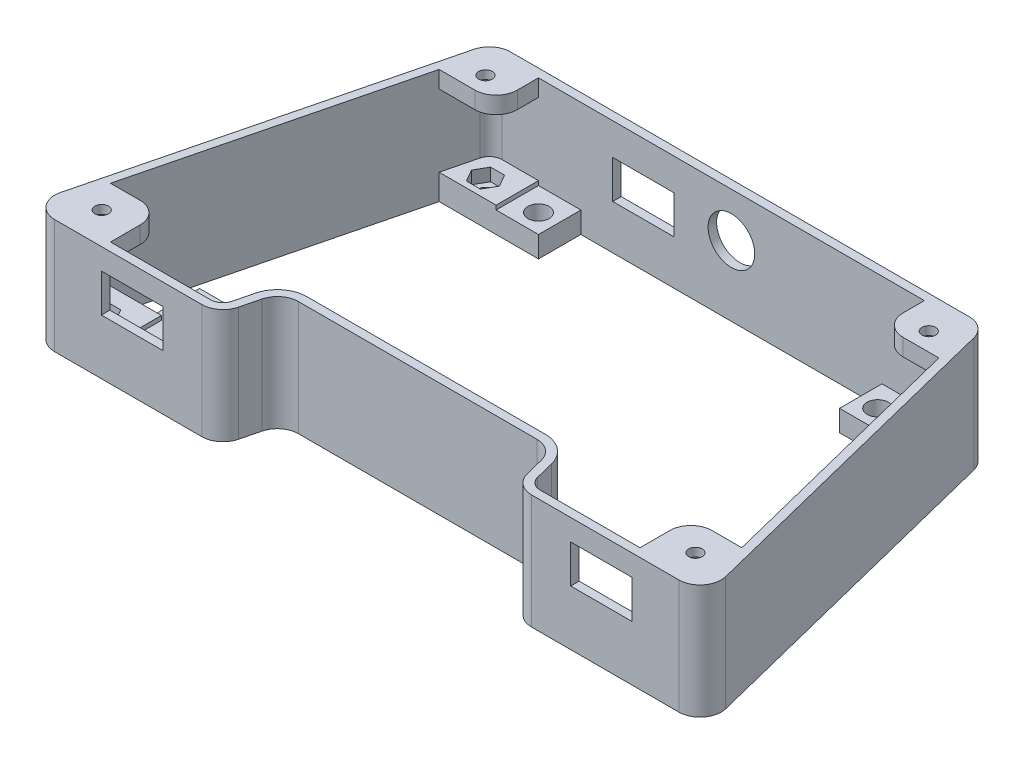
from build123d import *

# Parameters (mm, degrees)
Y_KSEKLIK_EKSTR_ZYON1_DEPTH      = 3
Y_KSEKLIK_EKSTR_ZYON2_DEPTH      = 24
KES_EKSTR_ZYON1_START            = -27
KES_EKSTR_ZYON1_DEPTH            = 27
IZIM4_R                          = 5.5
KES_EKSTR_ZYON2_DEPTH            = 10
IZIM5_W                          = 14.5
IZIM5_H                          = 9
KES_EKSTR_ZYON3_DEPTH            = 10
IZIM7_R                          = 1.65
Y_KSEKLIK_EKSTR_ZYON3_DEPTH      = 2
IZIM8_R                          = 1.65
Y_KSEKLIK_EKSTR_ZYON4_DEPTH      = 2
KES_EKSTR_ZYON5_DEPTH            = 10
IZIM13_W                         = 14.5
IZIM13_H                         = 9
KES_EKSTR_ZYON6_DEPTH            = 10
Y_KSEKLIK_EKSTR_ZYON5_START      = -2
Y_KSEKLIK_EKSTR_ZYON5_DEPTH      = 2
Y_KSEKLIK_EKSTR_ZYON6_DEPTH      = 3
Y_KSEKLIK_EKSTR_ZYON6_DEPTH_BACK = 2
IZIM15_W                         = 10
IZIM15_H                         = 12
IZIM15_R                         = 1.6
Y_KSEKLIK_EKSTR_ZYON7_DEPTH      = 4
IZIM17_R                         = 1.6
Y_KSEKLIK_EKSTR_ZYON8_DEPTH      = 3
IZIM18_R                         = 1.6
KES_EKSTR_ZYON7_DEPTH            = 3
KES_EKSTR_ZYON8_DEPTH            = 3
KES_EKSTR_ZYON9_DEPTH            = 10
IZIM21_R                         = 2.5
KES_EKSTR_ZYON10_DEPTH           = 10
Y_KSEKLIK_EKSTR_ZYON9_START      = -2
Y_KSEKLIK_EKSTR_ZYON9_DEPTH      = 2
Y_KSEKLIK_EKSTR_ZYON10_DEPTH     = 4
IZIM24_R                         = 1.6
Y_KSEKLIK_EKSTR_ZYON11_DEPTH     = 2
KES_EKSTR_ZYON12_START           = -10
IZIM25_R                         = 1.6
KES_EKSTR_ZYON12_DEPTH           = 10
KES_EKSTR_ZYON13_DEPTH           = 3
Y_KSEKLIK_EKSTR_ZYON12_DEPTH     = 3
IZIM28_W                         = 2
IZIM28_H                         = 8
Y_KSEKLIK_EKSTR_ZYON13_DEPTH     = 5
IZIM29_R                         = 2.5
KES_EKSTR_ZYON14_DEPTH           = 10
Y_KSEKLIK_EKSTR_ZYON14_DEPTH     = 5
Y_KSEKLIK_EKSTR_ZYON15_START     = -4
IZIM31_R                         = 1.6
Y_KSEKLIK_EKSTR_ZYON15_DEPTH     = 4
KES_EKSTR_ZYON15_DEPTH           = 2
RADYUS1_R                        = 5


with BuildPart() as part:
    # Çizim1 → Yükseklik-Ekstrüzyon1 (new body)
    with BuildSketch(Plane(origin=(0, 0, 0), x_dir=(1, 0, 0), z_dir=(0, 1, 0))):
        with BuildLine():
            Line((3.903882032, 0), (112.096117968, 0))
            ThreePointArc((112.096117968, 0), (115.173179015, -1.05897281), (116.946830469, -3.787321875))
            Line((116.946830469, -3.787321875), (136.446830469, -81.787321875))
            ThreePointArc((136.446830469, -81.787321875), (135.537145158, -86.077061047), (131.596117968, -88))
            Line((131.596117968, -88), (96.903882032, -88))
            ThreePointArc((96.903882032, -88), (93.826820985, -86.94102719), (92.053169531, -84.212678125))
            Line((92.053169531, -84.212678125), (90.946830469, -79.787321875))
            ThreePointArc((90.946830469, -79.787321875), (89.173179015, -77.05897281), (86.096117968, -76))
            Line((86.096117968, -76), (29.903882032, -76))
            ThreePointArc((29.903882032, -76), (26.826820985, -77.05897281), (25.053169531, -79.787321875))
            Line((25.053169531, -79.787321875), (23.946830469, -84.212678125))
            ThreePointArc((23.946830469, -84.212678125), (22.173179015, -86.94102719), (19.096117968, -88))
            Line((19.096117968, -88), (-15.596117968, -88))
            ThreePointArc((-15.596117968, -88), (-19.537145158, -86.077061047), (-20.446830469, -81.787321875))
            Line((-20.446830469, -81.787321875), (-0.946830469, -3.787321875))
            ThreePointArc((-0.946830469, -3.787321875), (0.826820985, -1.05897281), (3.903882032, 0))
        make_face()
    extrude(amount=Y_KSEKLIK_EKSTR_ZYON1_DEPTH)

    # Çizim2 → Yükseklik-Ekstrüzyon2 (add)
    with BuildSketch(Plane(origin=(0, 3, 0), x_dir=(1, 0, 0), z_dir=(0, 1, 0))):
        with BuildLine():
            Line((23.946830469, -84.212678125), (25.053169531, -79.787321875))
            ThreePointArc((25.053169531, -79.787321875), (26.826820985, -77.05897281), (29.903882032, -76))
            Line((29.903882032, -76), (86.096117968, -76))
            ThreePointArc((86.096117968, -76), (89.173179015, -77.05897281), (90.946830469, -79.787321875))
            Line((90.946830469, -79.787321875), (92.053169531, -84.212678125))
            ThreePointArc((92.053169531, -84.212678125), (93.826820985, -86.94102719), (96.903882032, -88))
            Line((96.903882032, -88), (131.596117968, -88))
            ThreePointArc((131.596117968, -88), (135.537145158, -86.077061047), (136.446830469, -81.787321875))
            Line((136.446830469, -81.787321875), (116.946830469, -3.787321875))
            ThreePointArc((116.946830469, -3.787321875), (115.173179015, -1.05897281), (112.096117968, 0))
            Line((112.096117968, 0), (3.903882032, 0))
            ThreePointArc((3.903882032, 0), (0.826820985, -1.05897281), (-0.946830469, -3.787321875))
            Line((-0.946830469, -3.787321875), (-20.446830469, -81.787321875))
            ThreePointArc((-20.446830469, -81.787321875), (-19.537145158, -86.077061047), (-15.596117968, -88))
            Line((-15.596117968, -88), (19.096117968, -88))
            ThreePointArc((19.096117968, -88), (22.173179015, -86.94102719), (23.946830469, -84.212678125))
        make_face()
        with BuildLine():
            Line((22.006545468, -83.727606875), (23.112884531, -79.302250625))
            ThreePointArc((23.112884531, -79.302250625), (25.595996566, -75.482561934), (29.903882032, -74))
            Line((29.903882032, -74), (86.096117968, -74))
            ThreePointArc((86.096117968, -74), (90.404003434, -75.482561934), (92.887115469, -79.302250625))
            Line((92.887115469, -79.302250625), (93.993454532, -83.727606875))
            ThreePointArc((93.993454532, -83.727606875), (95.057645404, -85.364616314), (96.903882032, -86))
            Line((96.903882032, -86), (131.596117968, -86))
            ThreePointArc((131.596117968, -86), (133.960734282, -84.846236628), (134.506545468, -82.272393125))
            Line((134.506545468, -82.272393125), (115.006545468, -4.272393125))
            ThreePointArc((115.006545468, -4.272393125), (113.942354596, -2.635383686), (112.096117968, -2))
            Line((112.096117968, -2), (3.903882032, -2))
            ThreePointArc((3.903882032, -2), (2.057645404, -2.635383686), (0.993454532, -4.272393125))
            Line((0.993454532, -4.272393125), (-18.506545468, -82.272393125))
            ThreePointArc((-18.506545468, -82.272393125), (-17.960734282, -84.846236628), (-15.596117968, -86))
            Line((-15.596117968, -86), (19.096117968, -86))
            ThreePointArc((19.096117968, -86), (20.942354596, -85.364616314), (22.006545468, -83.727606875))
        make_face(mode=Mode.SUBTRACT)
    extrude(amount=Y_KSEKLIK_EKSTR_ZYON2_DEPTH)

    # Çizim3 → Kes-Ekstrüzyon1 (cut)
    with BuildSketch(Plane(origin=(0, 3, 0), x_dir=(1, 0, 0), z_dir=(0, 1, 0)).offset(KES_EKSTR_ZYON1_START)):
        with BuildLine():
            Line((-15.596117968, -86), (19.096117968, -86))
            ThreePointArc((19.096117968, -86), (20.942354596, -85.364616314), (22.006545468, -83.727606875))
            Line((22.006545468, -83.727606875), (23.112884531, -79.302250625))
            ThreePointArc((23.112884531, -79.302250625), (25.595996566, -75.482561934), (29.903882032, -74))
            Line((29.903882032, -74), (86.096117968, -74))
            ThreePointArc((86.096117968, -74), (90.404003434, -75.482561934), (92.887115469, -79.302250625))
            Line((92.887115469, -79.302250625), (93.993454532, -83.727606875))
            ThreePointArc((93.993454532, -83.727606875), (95.057645404, -85.364616314), (96.903882032, -86))
            Line((96.903882032, -86), (131.596117968, -86))
            ThreePointArc((131.596117968, -86), (133.960734282, -84.846236628), (134.506545468, -82.272393125))
            Line((134.506545468, -82.272393125), (115.006545468, -4.272393125))
            ThreePointArc((115.006545468, -4.272393125), (113.942354596, -2.635383686), (112.096117968, -2))
            Line((112.096117968, -2), (3.903882032, -2))
            ThreePointArc((3.903882032, -2), (2.057645404, -2.635383686), (0.993454532, -4.272393125))
            Line((0.993454532, -4.272393125), (-18.506545468, -82.272393125))
            ThreePointArc((-18.506545468, -82.272393125), (-17.960734282, -84.846236628), (-15.596117968, -86))
        make_face()
    extrude(amount=KES_EKSTR_ZYON1_DEPTH, mode=Mode.SUBTRACT)

    # Çizim4 → Kes-Ekstrüzyon2 (cut)
    with BuildSketch(Plane(origin=(0, 0, 0), x_dir=(-1, 0, 0), z_dir=(0, 0, -1))):
        with Locations((-58, 16.5)):
            Circle(IZIM4_R)
    extrude(amount=-KES_EKSTR_ZYON2_DEPTH, mode=Mode.SUBTRACT)

    # Çizim5 → Kes-Ekstrüzyon3 (cut)
    with BuildSketch(Plane(origin=(0, 0, 0), x_dir=(-1, 0, 0), z_dir=(0, 0, -1))):
        with Locations((-37.25, 15)):
            Rectangle(IZIM5_W, IZIM5_H)
    extrude(amount=-KES_EKSTR_ZYON3_DEPTH, mode=Mode.SUBTRACT)

    # Çizim7 → Yükseklik-Ekstrüzyon3 (add)
    # profile 1 of 2: a face of its own
    with BuildSketch(Plane.XZ):
        with BuildLine():
            Line((10.561552813, 2), (10.561552813, 10))
            ThreePointArc((10.561552813, 10), (9.389979938, 12.828427125), (6.561552813, 14))
            Line((6.561552813, 14), (-1.438447187, 14))
            Line((-1.438447187, 14), (0.993454532, 4.272393125))
            ThreePointArc((0.993454532, 4.272393125), (2.057645404, 2.635383686), (3.903882032, 2))
            Line((3.903882032, 2), (10.561552813, 2))
        make_face()
        with Locations(Location((5.723812671, 7.731905405, 0), (0, 0, 270))):
            Circle(IZIM7_R, mode=Mode.SUBTRACT)
    # profile 2 of 2: a face of its own
    with BuildSketch(Plane.XZ):
        with BuildLine():
            Line((112.096117968, 2), (105.438447187, 2))
            Line((105.438447187, 2), (105.438447187, 10))
            ThreePointArc((105.438447187, 10), (106.610020062, 12.828427125), (109.438447187, 14))
            Line((109.438447187, 14), (117.438447187, 14))
            Line((117.438447187, 14), (115.006545468, 4.272393125))
            ThreePointArc((115.006545468, 4.272393125), (113.942354596, 2.635383686), (112.096117968, 2))
        make_face()
        with Locations(Location((110.276187329, 7.731905405, 0), (0, 0, 270))):
            Circle(IZIM7_R, mode=Mode.SUBTRACT)
    extrude(amount=-Y_KSEKLIK_EKSTR_ZYON3_DEPTH)

    # Çizim8 → Yükseklik-Ekstrüzyon4 (add)
    # profile 1 of 2: a face of its own
    with BuildSketch(Plane.XZ):
        with BuildLine():
            Line((132.438447187, 74), (124.438447187, 74))
            ThreePointArc((124.438447187, 74), (121.610020062, 75.171572875), (120.438447187, 78))
            Line((120.438447187, 78), (120.438447187, 86))
            Line((120.438447187, 86), (131.596117968, 86))
            ThreePointArc((131.596117968, 86), (133.960734282, 84.846236628), (134.506545468, 82.272393125))
            Line((134.506545468, 82.272393125), (132.438447187, 74))
        make_face()
        with Locations(Location((128.017282578, 80.5, 0), (0, 0, 270))):
            Circle(IZIM8_R, mode=Mode.SUBTRACT)
    # profile 2 of 2: a face of its own
    with BuildSketch(Plane.XZ):
        with BuildLine():
            Line((-16.438447187, 74), (-18.506545468, 82.272393125))
            ThreePointArc((-18.506545468, 82.272393125), (-17.960734282, 84.846236628), (-15.596117968, 86))
            Line((-15.596117968, 86), (-4.438447187, 86))
            Line((-4.438447187, 86), (-4.438447187, 78))
            ThreePointArc((-4.438447187, 78), (-5.610020062, 75.171572875), (-8.438447187, 74))
            Line((-8.438447187, 74), (-16.438447187, 74))
        make_face()
        with Locations(Location((-12.017282578, 80.5, 0), (0, 0, 90))):
            Circle(IZIM8_R, mode=Mode.SUBTRACT)
    extrude(amount=-Y_KSEKLIK_EKSTR_ZYON4_DEPTH)

    # Çizim12 → Kes-Ekstrüzyon5 (cut)
    with BuildSketch(Plane(origin=(0, 2, 0), x_dir=(1, 0, 0), z_dir=(0, 1, 0))):
        Polygon((7.455863478, -4.731905405), (3.991761863, -4.731905405), (2.259711056, -7.731905405), (3.991761863, -10.731905405), (7.455863478, -10.731905405), (9.187914286, -7.731905405), align=None)
        Polygon((-8.553180962, -80.5), (-10.28523177, -77.5), (-13.749333385, -77.5), (-15.481384193, -80.5), (-13.749333385, -83.5), (-10.28523177, -83.5), align=None)
        Polygon((126.28523177, -83.5), (124.553180962, -80.5), (126.28523177, -77.5), (129.749333385, -77.5), (131.481384193, -80.5), (129.749333385, -83.5), align=None)
        Polygon((106.812085714, -7.731905405), (108.544136522, -4.731905405), (112.008238137, -4.731905405), (113.740288944, -7.731905405), (112.008238137, -10.731905405), (108.544136522, -10.731905405), align=None)
    extrude(amount=-KES_EKSTR_ZYON5_DEPTH, mode=Mode.SUBTRACT)

    # Çizim13 → Kes-Ekstrüzyon6 (cut)
    with BuildSketch(Plane.XY.offset(88)):
        with Locations((2.653882032, 17.5)):
            Rectangle(IZIM13_W, IZIM13_H)
        with Locations((113.343882032, 17.5)):
            Rectangle(IZIM13_W, IZIM13_H)
    extrude(amount=-KES_EKSTR_ZYON6_DEPTH, mode=Mode.SUBTRACT)

    # Çizim14 → Yükseklik-Ekstrüzyon5 (add)
    with BuildSketch(Plane(origin=(0, 2, 0), x_dir=(1, 0, 0), z_dir=(0, 1, 0)).offset(Y_KSEKLIK_EKSTR_ZYON5_START)):
        with BuildLine():
            Line((6.561552813, -14), (12.5, -14))
            Line((12.5, -14), (12.5, -2))
            Line((12.5, -2), (10.561552813, -2))
            Line((10.561552813, -2), (10.561552813, -10))
            ThreePointArc((10.561552813, -10), (9.389979938, -12.828427125), (6.561552813, -14))
        make_face()
        with BuildLine():
            Line((109.438447187, -14), (103.5, -14))
            Line((103.5, -14), (103.5, -2))
            Line((103.5, -2), (105.438447187, -2))
            Line((105.438447187, -2), (105.438447187, -10))
            ThreePointArc((105.438447187, -10), (106.610020062, -12.828427125), (109.438447187, -14))
        make_face()
    extrude(amount=Y_KSEKLIK_EKSTR_ZYON5_DEPTH)

    # Çizim15 → Yükseklik-Ekstrüzyon6 (add, two sides: drawn at the far end of the back side and taken through both)
    # profile 1 of 2: a face of its own
    with BuildSketch(Plane(origin=(0, 2, 0), x_dir=(1, 0, 0), z_dir=(0, 1, 0)).offset(-Y_KSEKLIK_EKSTR_ZYON6_DEPTH_BACK)):
        with Locations((17.5, -8)):
            Rectangle(IZIM15_W, IZIM15_H)
        with Locations(Location((18, -7.5, 0), (0, 0, 270))):
            Circle(IZIM15_R, mode=Mode.SUBTRACT)
    # profile 2 of 2: a face of its own
    with BuildSketch(Plane(origin=(0, 2, 0), x_dir=(1, 0, 0), z_dir=(0, 1, 0)).offset(-Y_KSEKLIK_EKSTR_ZYON6_DEPTH_BACK)):
        with Locations((98.5, -8)):
            Rectangle(IZIM15_W, IZIM15_H)
        with Locations(Location((98, -7.5, 0), (0, 0, 270))):
            Circle(IZIM15_R, mode=Mode.SUBTRACT)
    extrude(amount=Y_KSEKLIK_EKSTR_ZYON6_DEPTH + Y_KSEKLIK_EKSTR_ZYON6_DEPTH_BACK)

    # Çizim16 → Yükseklik-Ekstrüzyon7 (add)
    with BuildSketch(Plane(origin=(0, 2, 0), x_dir=(1, 0, 0), z_dir=(0, 1, 0))):
        with BuildLine():
            Line((12.5, -2), (3.903882032, -2))
            ThreePointArc((3.903882032, -2), (2.057645404, -2.635383686), (0.993454532, -4.272393125))
            Line((0.993454532, -4.272393125), (-1.438447187, -14))
            Line((-1.438447187, -14), (12.5, -14))
            Line((12.5, -14), (12.5, -2))
        make_face()
        with BuildLine():
            Line((112.096117968, -2), (103.5, -2))
            Line((103.5, -2), (103.5, -14))
            Line((103.5, -14), (117.438447187, -14))
            Line((117.438447187, -14), (115.006545468, -4.272393125))
            ThreePointArc((115.006545468, -4.272393125), (113.942354596, -2.635383686), (112.096117968, -2))
        make_face()
    extrude(amount=Y_KSEKLIK_EKSTR_ZYON7_DEPTH)

    # Çizim17 → Yükseklik-Ekstrüzyon8 (add)
    # profile 1 of 2: a face of its own
    with BuildSketch(Plane.XZ):
        Polygon((112.008238137, 4.731905405), (113.740288944, 7.731905405), (112.008238137, 10.731905405), (108.544136522, 10.731905405), (106.812085714, 7.731905405), (108.544136522, 4.731905405), align=None)
        with Locations(Location((110.276187329, 7.731905405, 0), (0, 0, 270))):
            Circle(IZIM17_R, mode=Mode.SUBTRACT)
    # profile 2 of 2: a face of its own
    with BuildSketch(Plane.XZ):
        Polygon((7.455863478, 4.731905405), (9.187914286, 7.731905405), (7.455863478, 10.731905405), (3.991761863, 10.731905405), (2.259711056, 7.731905405), (3.991761863, 4.731905405), align=None)
        with Locations(Location((5.723812671, 7.731905405, 0), (0, 0, 270))):
            Circle(IZIM17_R, mode=Mode.SUBTRACT)
    extrude(amount=-Y_KSEKLIK_EKSTR_ZYON8_DEPTH)

    # Çizim18 → Kes-Ekstrüzyon7 (cut)
    with BuildSketch(Plane.XZ.offset(-2)):
        with Locations(Location((110.276187329, 7.731905405, 0), (0, 0, 270))):
            Circle(IZIM18_R)
        with Locations(Location((5.723812671, 7.731905405, 0), (0, 0, 270))):
            Circle(IZIM18_R)
    extrude(amount=-KES_EKSTR_ZYON7_DEPTH, mode=Mode.SUBTRACT)

    # Çizim19 → Kes-Ekstrüzyon8 (cut)
    with BuildSketch(Plane(origin=(0, 6, 0), x_dir=(1, 0, 0), z_dir=(0, 1, 0))):
        Polygon((7.369260938, -4.881905405), (4.078364403, -4.881905405), (2.432916136, -7.731905405), (4.078364403, -10.581905405), (7.369260938, -10.581905405), (9.014709205, -7.731905405), align=None)
        Polygon((106.985290795, -7.731905405), (108.630739062, -10.581905405), (111.921635597, -10.581905405), (113.567083864, -7.731905405), (111.921635597, -4.881905405), (108.630739062, -4.881905405), align=None)
    extrude(amount=-KES_EKSTR_ZYON8_DEPTH, mode=Mode.SUBTRACT)

    # Çizim20 → Kes-Ekstrüzyon9 (cut)
    with BuildSketch(Plane(origin=(0, 6, 0), x_dir=(1, 0, 0), z_dir=(0, 1, 0))):
        Polygon((-0.938447187, -12), (-1.438447187, -14), (12.5, -14), (12.5, -12), align=None)
        Polygon((12.5, -12), (12.5, -14), (117.438447187, -14), (116.938447187, -12), align=None)
    extrude(amount=-KES_EKSTR_ZYON9_DEPTH, mode=Mode.SUBTRACT)

    # Çizim21 → Kes-Ekstrüzyon10 (cut)
    with BuildSketch(Plane(origin=(0, 5, 0), x_dir=(1, 0, 0), z_dir=(0, 1, 0))):
        with Locations(Location((18, -7.5, 0), (0, 0, 270))):
            Circle(IZIM21_R)
        with Locations(Location((98, -7.5, 0), (0, 0, 270))):
            Circle(IZIM21_R)
    extrude(amount=-KES_EKSTR_ZYON10_DEPTH, mode=Mode.SUBTRACT)

    # Çizim22 → Yükseklik-Ekstrüzyon9 (add)
    with BuildSketch(Plane(origin=(0, 2, 0), x_dir=(1, 0, 0), z_dir=(0, 1, 0)).offset(Y_KSEKLIK_EKSTR_ZYON9_START)):
        with BuildLine():
            Line((5.561552813, -86), (-4.438447187, -86))
            Line((-4.438447187, -86), (-4.438447187, -78))
            ThreePointArc((-4.438447187, -78), (-5.610020062, -75.171572875), (-8.438447187, -74))
            Line((-8.438447187, -74), (-4.438447187, -74))
            Line((-4.438447187, -74), (-4.438447187, -66))
            Line((-4.438447187, -66), (5.561552813, -66))
            Line((5.561552813, -66), (5.561552813, -86))
        make_face()
        with BuildLine():
            Line((110.438447187, -86), (120.438447187, -86))
            Line((120.438447187, -86), (120.438447187, -78))
            ThreePointArc((120.438447187, -78), (121.610020062, -75.171572875), (124.438447187, -74))
            Line((124.438447187, -74), (120.438447187, -74))
            Line((120.438447187, -74), (120.438447187, -66))
            Line((120.438447187, -66), (110.438447187, -66))
            Line((110.438447187, -66), (110.438447187, -86))
        make_face()
    extrude(amount=Y_KSEKLIK_EKSTR_ZYON9_DEPTH)

    # Çizim23 → Yükseklik-Ekstrüzyon10 (add)
    # profile 1 of 3: a face of its own
    with BuildSketch(Plane(origin=(0, 2, 0), x_dir=(1, 0, 0), z_dir=(0, 1, 0))):
        with BuildLine():
            Line((-16.438447187, -74), (-18.506545468, -82.272393125))
            ThreePointArc((-18.506545468, -82.272393125), (-17.960734282, -84.846236628), (-15.596117968, -86))
            Line((-15.596117968, -86), (-4.438447187, -86))
            Line((-4.438447187, -86), (-4.438447187, -74))
            Line((-4.438447187, -74), (-16.438447187, -74))
        make_face()
    # profile 2 of 3: a face of its own
    with BuildSketch(Plane(origin=(0, 2, 0), x_dir=(1, 0, 0), z_dir=(0, 1, 0))):
        with BuildLine():
            Line((132.438447187, -74), (120.438447187, -74))
            Line((120.438447187, -74), (120.438447187, -86))
            Line((120.438447187, -86), (131.596117968, -86))
            ThreePointArc((131.596117968, -86), (133.960734282, -84.846236628), (134.506545468, -82.272393125))
            Line((134.506545468, -82.272393125), (132.438447187, -74))
        make_face()
        Polygon((129.749333385, -77.5), (131.481384193, -80.5), (129.749333385, -83.5), (126.28523177, -83.5), (124.553180962, -80.5), (126.28523177, -77.5), align=None, mode=Mode.SUBTRACT)
    # profile 3 of 3: a face of its own
    with BuildSketch(Plane(origin=(0, 2, 0), x_dir=(1, 0, 0), z_dir=(0, 1, 0))):
        Polygon((131.481384193, -80.5), (129.749333385, -83.5), (126.28523177, -83.5), (124.553180962, -80.5), (126.28523177, -77.5), (129.749333385, -77.5), align=None)
    extrude(amount=Y_KSEKLIK_EKSTR_ZYON10_DEPTH)

    # Çizim24 → Yükseklik-Ekstrüzyon11 (add)
    # profile 1 of 2: a face of its own
    with BuildSketch(Plane.XZ.offset(-2)):
        Polygon((129.749333385, 77.5), (131.481384193, 80.5), (129.749333385, 83.5), (126.28523177, 83.5), (124.553180962, 80.5), (126.28523177, 77.5), align=None)
        with Locations(Location((128.017282578, 80.5, 0), (0, 0, 270))):
            Circle(IZIM24_R, mode=Mode.SUBTRACT)
    # profile 2 of 2: a face of its own
    with BuildSketch(Plane.XZ.offset(-2)):
        Polygon((-10.28523177, 77.5), (-8.553180962, 80.5), (-10.28523177, 83.5), (-13.749333385, 83.5), (-15.481384193, 80.5), (-13.749333385, 77.5), align=None)
        with Locations(Location((-12.017282578, 80.5, 0), (0, 0, 270))):
            Circle(IZIM24_R, mode=Mode.SUBTRACT)
    extrude(amount=Y_KSEKLIK_EKSTR_ZYON11_DEPTH)

    # Çizim25 → Kes-Ekstrüzyon12 (cut)
    with BuildSketch(Plane.XZ.offset(-2).offset(KES_EKSTR_ZYON12_START)):
        with Locations(Location((128.017282578, 80.5, 0), (0, 0, 90))):
            Circle(IZIM25_R)
        with Locations(Location((-12.017282578, 80.5, 0), (0, 0, 90))):
            Circle(IZIM25_R)
    extrude(amount=KES_EKSTR_ZYON12_DEPTH, mode=Mode.SUBTRACT)

    # Çizim26 → Kes-Ekstrüzyon13 (cut)
    with BuildSketch(Plane(origin=(0, 6, 0), x_dir=(1, 0, 0), z_dir=(0, 1, 0))):
        Polygon((-10.37183431, -77.65), (-13.662730845, -77.65), (-15.308179112, -80.5), (-13.662730845, -83.35), (-10.37183431, -83.35), (-8.726386043, -80.5), align=None)
        Polygon((129.662730845, -77.65), (126.37183431, -77.65), (124.726386043, -80.5), (126.37183431, -83.35), (129.662730845, -83.35), (131.308179112, -80.5), align=None)
    extrude(amount=-KES_EKSTR_ZYON13_DEPTH, mode=Mode.SUBTRACT)

    # Çizim27 → Yükseklik-Ekstrüzyon12 (add)
    with BuildSketch(Plane(origin=(0, 2, 0), x_dir=(1, 0, 0), z_dir=(0, 1, 0))):
        Polygon((-4.438447187, -74), (-4.438447187, -86), (5.561552813, -86), (5.561552813, -66), (-4.438447187, -66), align=None)
        Polygon((120.438447187, -86), (120.438447187, -74), (120.438447187, -66), (110.438447187, -66), (110.438447187, -86), align=None)
    extrude(amount=Y_KSEKLIK_EKSTR_ZYON12_DEPTH)

    # Çizim28 → Yükseklik-Ekstrüzyon13 (add)
    with BuildSketch(Plane(origin=(0, 5, 0), x_dir=(1, 0, 0), z_dir=(0, 1, 0))):
        with Locations((-5.438447187, -70)):
            Rectangle(IZIM28_W, IZIM28_H)
        with Locations((121.438447187, -70)):
            Rectangle(IZIM28_W, IZIM28_H)
    extrude(amount=-Y_KSEKLIK_EKSTR_ZYON13_DEPTH)

    # Çizim29 → Kes-Ekstrüzyon14 (cut)
    with BuildSketch(Plane(origin=(0, 5, 0), x_dir=(1, 0, 0), z_dir=(0, 1, 0))):
        with Locations((-1.998447187, -67.5)):
            Circle(IZIM29_R)
        with Locations((117.998447187, -67.5)):
            Circle(IZIM29_R)
    extrude(amount=-KES_EKSTR_ZYON14_DEPTH, mode=Mode.SUBTRACT)

    # Çizim30 → Yükseklik-Ekstrüzyon14 (add)
    with BuildSketch(Plane(origin=(0, 5, 0), x_dir=(1, 0, 0), z_dir=(0, 1, 0))):
        with BuildLine():
            Line((110.438447187, -66), (115.998447187, -66))
            ThreePointArc((115.998447187, -66), (117.998447187, -65), (119.998447187, -66))
            Line((119.998447187, -66), (122.438447187, -66))
            Line((122.438447187, -66), (122.438447187, -63))
            Line((122.438447187, -63), (110.438447187, -63))
            Line((110.438447187, -63), (110.438447187, -66))
        make_face()
        with BuildLine():
            Line((-6.438447187, -66), (-3.998447187, -66))
            ThreePointArc((-3.998447187, -66), (-1.998447187, -65), (0.001552813, -66))
            Line((0.001552813, -66), (5.561552813, -66))
            Line((5.561552813, -66), (5.561552813, -63))
            Line((5.561552813, -63), (-6.438447187, -63))
            Line((-6.438447187, -63), (-6.438447187, -66))
        make_face()
    extrude(amount=-Y_KSEKLIK_EKSTR_ZYON14_DEPTH)

    # Çizim31 → Yükseklik-Ekstrüzyon15 (add)
    # profile 1 of 4: a face of its own
    with BuildSketch(Plane(origin=(0, 27, 0), x_dir=(1, 0, 0), z_dir=(0, 1, 0)).offset(Y_KSEKLIK_EKSTR_ZYON15_START)):
        with BuildLine():
            Line((0.993454532, -4.272393125), (-0.938447187, -12))
            Line((-0.938447187, -12), (12.5, -12))
            Line((12.5, -12), (12.5, -2))
            Line((12.5, -2), (3.903882032, -2))
            ThreePointArc((3.903882032, -2), (2.057645404, -2.635383686), (0.993454532, -4.272393125))
        make_face()
        with Locations(Location((5.723812671, -7.731905405, 0), (0, 0, 90))):
            Circle(IZIM31_R, mode=Mode.SUBTRACT)
    # profile 2 of 4: a face of its own
    with BuildSketch(Plane(origin=(0, 27, 0), x_dir=(1, 0, 0), z_dir=(0, 1, 0)).offset(Y_KSEKLIK_EKSTR_ZYON15_START)):
        with BuildLine():
            Line((103.5, -2), (103.5, -12))
            Line((103.5, -12), (116.938447187, -12))
            Line((116.938447187, -12), (115.006545468, -4.272393125))
            ThreePointArc((115.006545468, -4.272393125), (113.942354596, -2.635383686), (112.096117968, -2))
            Line((112.096117968, -2), (103.5, -2))
        make_face()
        with Locations(Location((110.276187329, -7.731905405, 0), (0, 0, 90))):
            Circle(IZIM31_R, mode=Mode.SUBTRACT)
    # profile 3 of 4: a face of its own
    with BuildSketch(Plane(origin=(0, 27, 0), x_dir=(1, 0, 0), z_dir=(0, 1, 0)).offset(Y_KSEKLIK_EKSTR_ZYON15_START)):
        with BuildLine():
            Line((132.438447187, -74), (120.438447187, -74))
            Line((120.438447187, -74), (120.438447187, -86))
            Line((120.438447187, -86), (131.596117968, -86))
            ThreePointArc((131.596117968, -86), (133.960734282, -84.846236628), (134.506545468, -82.272393125))
            Line((134.506545468, -82.272393125), (132.438447187, -74))
        make_face()
        with Locations(Location((128.017282578, -80.5, 0), (0, 0, 270))):
            Circle(IZIM31_R, mode=Mode.SUBTRACT)
    # profile 4 of 4: a face of its own
    with BuildSketch(Plane(origin=(0, 27, 0), x_dir=(1, 0, 0), z_dir=(0, 1, 0)).offset(Y_KSEKLIK_EKSTR_ZYON15_START)):
        with BuildLine():
            Line((-16.438447187, -74), (-18.506545468, -82.272393125))
            ThreePointArc((-18.506545468, -82.272393125), (-17.960734282, -84.846236628), (-15.596117968, -86))
            Line((-15.596117968, -86), (-4.438447187, -86))
            Line((-4.438447187, -86), (-4.438447187, -74))
            Line((-4.438447187, -74), (-16.438447187, -74))
        make_face()
        with Locations(Location((-12.017282578, -80.5, 0), (0, 0, 270))):
            Circle(IZIM31_R, mode=Mode.SUBTRACT)
    extrude(amount=Y_KSEKLIK_EKSTR_ZYON15_DEPTH)

    # Çizim32 → Kes-Ekstrüzyon15 (cut)
    with BuildSketch(Plane.XZ.offset(-23)):
        Polygon((126.37183431, 77.65), (129.662730845, 77.65), (131.308179112, 80.5), (129.662730845, 83.35), (126.37183431, 83.35), (124.726386043, 80.5), align=None)
        Polygon((-10.37183431, 77.65), (-8.726386043, 80.5), (-10.37183431, 83.35), (-13.662730845, 83.35), (-15.308179112, 80.5), (-13.662730845, 77.65), align=None)
        Polygon((108.630739062, 10.581905405), (106.985290795, 7.731905405), (108.630739062, 4.881905405), (111.921635597, 4.881905405), (113.567083864, 7.731905405), (111.921635597, 10.581905405), align=None)
        Polygon((4.078364403, 10.581905405), (2.432916136, 7.731905405), (4.078364403, 4.881905405), (7.369260938, 4.881905405), (9.014709205, 7.731905405), (7.369260938, 10.581905405), align=None)
    extrude(amount=-KES_EKSTR_ZYON15_DEPTH, mode=Mode.SUBTRACT)

    # Radyus1
    radyus1_edges = [part.edges().sort_by_distance(p)[0] for p in [
        (103.5, 25, 12),
        (120.438447187, 25, 74),
        (-4.438447187, 25, 74),
        (12.5, 25, 12),
    ]]
    fillet(radyus1_edges, radius=RADYUS1_R)


solid = part.part
